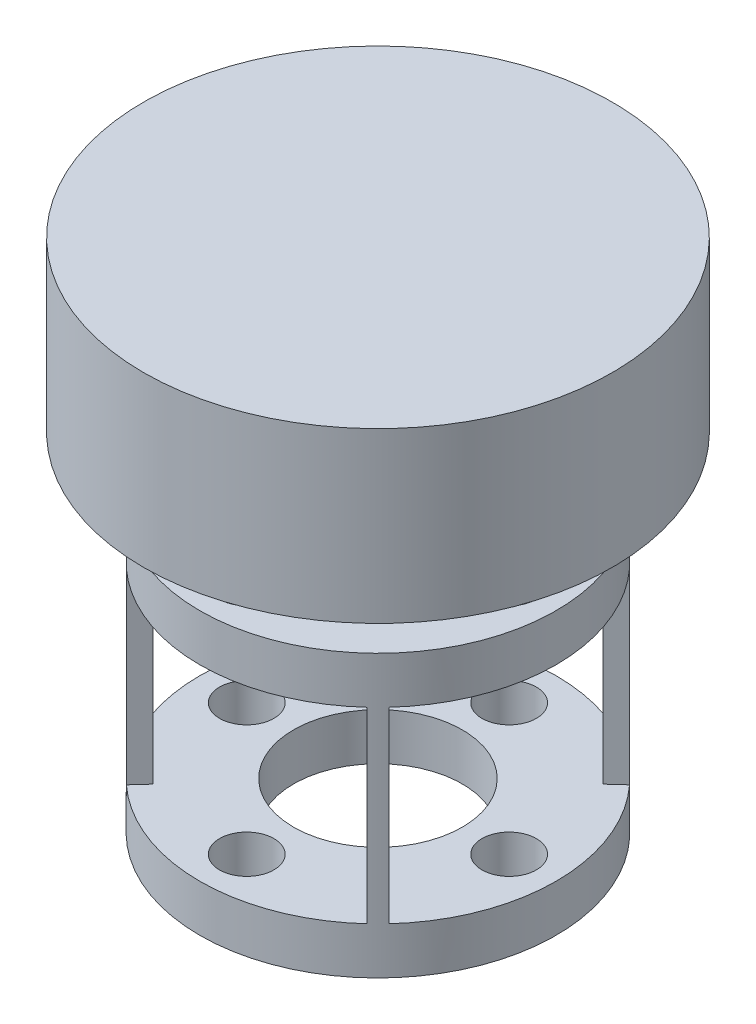
from build123d import *
from build123d.topology import SkipClean

# Parameters (mm, degrees)
SKETCH1_R               = 19
BOSS_EXTRUDE1_DEPTH     = 5
BOSS_EXTRUDE4_DEPTH     = 20
SKETCH5_R               = 19
BOSS_EXTRUDE5_DEPTH     = 5
CUT_EXTRUDE1_DEPTH      = 37.701498607
CUT_EXTRUDE1_DEPTH_BACK = 5
SKETCH2_7_R             = 2.9
SKETCH1_3_R             = 9
CUT_EXTRUDE2_DEPTH      = 10
SKETCH6_R               = 2.5
BOSS_EXTRUDE7_DEPTH     = 25
FILLET1_R               = 5
SKETCH8_R               = 25
BOSS_EXTRUDE8_DEPTH     = 18


with BuildPart() as part:
    # Sketch1 → Boss-Extrude1 (new body)
    with BuildSketch(Plane(origin=(0, 0, 0), x_dir=(1, 0, 0), z_dir=(0, 1, 0))):
        Circle(SKETCH1_R)
    extrude(amount=BOSS_EXTRUDE1_DEPTH)

    # Sketch2 → Boss-Extrude4 (add)
    with SkipClean():  # the faces are left unmerged after this step: merging them gives an invalid solid
        with BuildSketch(Plane(origin=(0, 5, 0), x_dir=(1, 0, 0), z_dir=(0, 1, 0))):
            with BuildLine():
                Line((-14.008269399, 12.836213945), (-12.533714726, 11.485033529))
                ThreePointArc((-12.533714726, 11.485033529), (-12.02081528, 12.02081528), (-11.485033529, 12.533714726))
                Line((-11.485033529, 12.533714726), (-12.836213945, 14.008269399))
                ThreePointArc((-12.836213945, 14.008269399), (-13.435028843, 13.435028843), (-14.008269399, 12.836213945))
            make_face()
            with BuildLine():
                Line((14.008269399, 12.836213945), (12.533714726, 11.485033529))
                ThreePointArc((12.533714726, 11.485033529), (12.02081528, 12.02081528), (11.485033529, 12.533714726))
                Line((11.485033529, 12.533714726), (12.836213945, 14.008269399))
                ThreePointArc((12.836213945, 14.008269399), (13.435028843, 13.435028843), (14.008269399, 12.836213945))
            make_face()
            with BuildLine():
                Line((12.836213945, -14.008269399), (11.485033529, -12.533714726))
                ThreePointArc((11.485033529, -12.533714726), (12.02081528, -12.02081528), (12.533714726, -11.485033529))
                Line((12.533714726, -11.485033529), (14.008269399, -12.836213945))
                ThreePointArc((14.008269399, -12.836213945), (13.435028843, -13.435028843), (12.836213945, -14.008269399))
            make_face()
            with BuildLine():
                Line((-14.008269399, -12.836213945), (-12.533714726, -11.485033529))
                ThreePointArc((-12.533714726, -11.485033529), (-12.02081528, -12.02081528), (-11.485033529, -12.533714726))
                Line((-11.485033529, -12.533714726), (-12.836213945, -14.008269399))
                ThreePointArc((-12.836213945, -14.008269399), (-13.435028843, -13.435028843), (-14.008269399, -12.836213945))
            make_face()
        extrude(amount=BOSS_EXTRUDE4_DEPTH)

    # Sketch5 → Boss-Extrude5 (add)
    with SkipClean():  # the faces are left unmerged after this step: merging them gives an invalid solid
        with BuildSketch(Plane(origin=(0, 25, 0), x_dir=(1, 0, 0), z_dir=(0, 1, 0))):
            Circle(SKETCH5_R)
        extrude(amount=BOSS_EXTRUDE5_DEPTH)

    # Sketch2<7> → Cut-Extrude1 (cut, two sides: drawn at the far end of the back side and taken through both)
    with SkipClean():  # the faces are left unmerged after this step: merging them gives an invalid solid
        with BuildSketch(Plane(origin=(0, 5, 0), x_dir=(1, 0, 0), z_dir=(0, 1, 0)).offset(-CUT_EXTRUDE1_DEPTH_BACK)):
            with Locations((0, 14)):
                Circle(SKETCH2_7_R)
            with Locations((14, 0)):
                Circle(SKETCH2_7_R)
            with Locations((0, -14)):
                Circle(SKETCH2_7_R)
            with Locations((-14, 0)):
                Circle(SKETCH2_7_R)
        extrude(amount=CUT_EXTRUDE1_DEPTH + CUT_EXTRUDE1_DEPTH_BACK, mode=Mode.SUBTRACT)

    # Sketch1<3> → Cut-Extrude2 (cut)
    with SkipClean():  # the faces are left unmerged after this step: merging them gives an invalid solid
        with BuildSketch(Plane(origin=(0, 0, 0), x_dir=(1, 0, 0), z_dir=(0, 1, 0))):
            Circle(SKETCH1_3_R)
        extrude(amount=CUT_EXTRUDE2_DEPTH, mode=Mode.SUBTRACT)

    # Sketch6 → Boss-Extrude7 (add)
    with SkipClean():  # the faces are left unmerged after this step: merging them gives an invalid solid
        with BuildSketch(Plane(origin=(0, 30, 0), x_dir=(1, 0, 0), z_dir=(0, 1, 0))):
            Circle(SKETCH6_R)
        extrude(amount=BOSS_EXTRUDE7_DEPTH)

    # Fillet1
    fillet1_edges = [part.edges().sort_by_distance(p)[0] for p in [
        (-2.5, 30, 0),
    ]]
    fillet(fillet1_edges, radius=FILLET1_R)

    # Sketch8 → Boss-Extrude8 (add)
    with SkipClean():  # the faces are left unmerged after this step: merging them gives an invalid solid
        with BuildSketch(Plane(origin=(0, 55, 0), x_dir=(1, 0, 0), z_dir=(0, 1, 0))):
            Circle(SKETCH8_R)
        extrude(amount=-BOSS_EXTRUDE8_DEPTH)


solid = part.part
